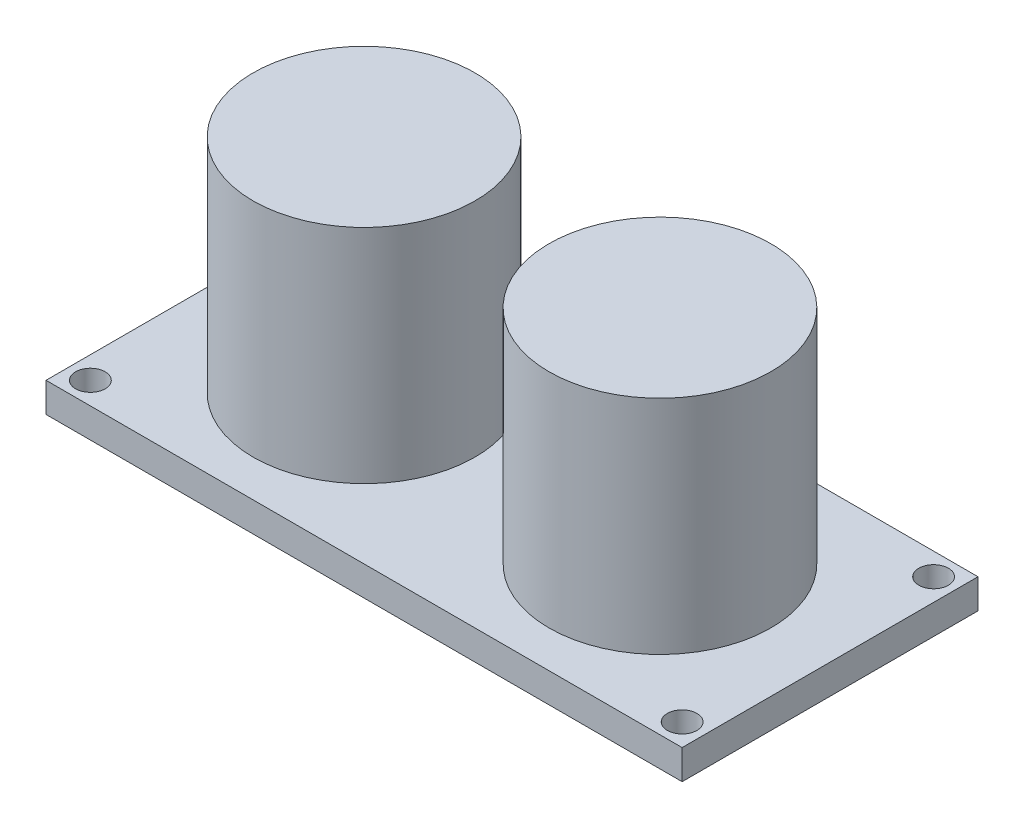
from build123d import *

# Parameters (mm, degrees)
SKETCH1_W           = 43
SKETCH1_H           = 20
BOSS_EXTRUDE1_DEPTH = 2
SKETCH2_R           = 1
CUT_EXTRUDE1_DEPTH  = 2
SKETCH3_R           = 7.5
BOSS_EXTRUDE2_DEPTH = 15


with BuildPart() as part:
    # Sketch1 → Boss-Extrude1 (new body)
    with BuildSketch(Plane(origin=(0, 0, 0), x_dir=(1, 0, 0), z_dir=(0, 1, 0))):
        with Locations((1.884331799, -1.591272186)):
            Rectangle(SKETCH1_W, SKETCH1_H)
    extrude(amount=BOSS_EXTRUDE1_DEPTH)

    # Sketch2 → Cut-Extrude1 (cut)
    with BuildSketch(Plane(origin=(0, 2, 0), x_dir=(1, 0, 0), z_dir=(0, 1, 0))):
        with Locations(Location((-18.115668201, -10.091272186, 0), (0, 0, 270))):
            Circle(SKETCH2_R)
        with Locations(Location((21.884331799, -10.091272186, 0), (0, 0, 270))):
            Circle(SKETCH2_R)
        with Locations(Location((-18.115668201, 6.908727814, 0), (0, 0, 270))):
            Circle(SKETCH2_R)
        with Locations(Location((21.884331799, 6.908727814, 0), (0, 0, 270))):
            Circle(SKETCH2_R)
    extrude(amount=-CUT_EXTRUDE1_DEPTH, mode=Mode.SUBTRACT)

    # Sketch3 → Boss-Extrude2 (add)
    with BuildSketch(Plane(origin=(0, 2, 0), x_dir=(1, 0, 0), z_dir=(0, 1, 0))):
        with Locations(Location((11.884331799, -1.591272186, 0), (0, 0, 270))):
            Circle(SKETCH3_R)
        with Locations(Location((-8.115668201, -1.591272186, 0), (0, 0, 270))):
            Circle(SKETCH3_R)
    extrude(amount=BOSS_EXTRUDE2_DEPTH)


solid = part.part
